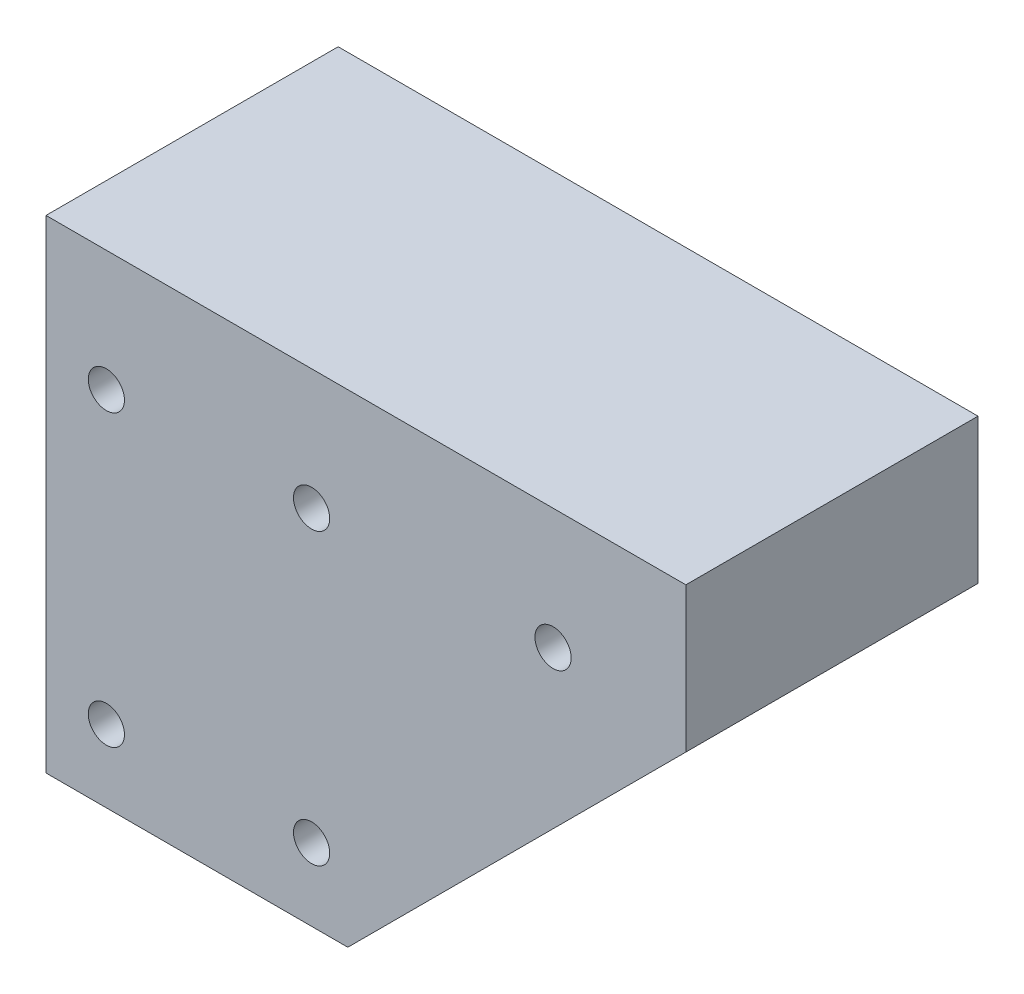
from build123d import *

# Parameters (mm, degrees)
SKETCH_1_W          = 53
SKETCH_1_H          = 40
EXTRUDE_1_DEPTH     = 24.2
CUT_EXTRUDE_1_DEPTH = 71.672767032
SKETCH_3_R          = 1.5
CUT_EXTRUDE_2_DEPTH = 71.672767032


with BuildPart() as part:
    # 草图1 → 凸台-拉伸1 (new body)
    with BuildSketch(Plane.XY):
        with Locations((26.5, 20)):
            Rectangle(SKETCH_1_W, SKETCH_1_H)
    extrude(amount=EXTRUDE_1_DEPTH)

    # 草图2 → 切除-拉伸1 (cut, through all)
    with BuildSketch(Plane.XY.offset(24.2)):
        Polygon((53, 28), (53, 0), (25, 0), align=None)
    extrude(amount=-CUT_EXTRUDE_1_DEPTH, mode=Mode.SUBTRACT)

    # 草图3 → 切除-拉伸2 (cut, through all)
    with BuildSketch(Plane.XY.offset(24.2)):
        with Locations((5, 30)):
            Circle(SKETCH_3_R)
        with Locations((5, 6)):
            Circle(SKETCH_3_R)
        with Locations((22, 30)):
            Circle(SKETCH_3_R)
        with Locations((22, 6)):
            Circle(SKETCH_3_R)
        with Locations((42, 30)):
            Circle(SKETCH_3_R)
    extrude(amount=-CUT_EXTRUDE_2_DEPTH, mode=Mode.SUBTRACT)


solid = part.part
